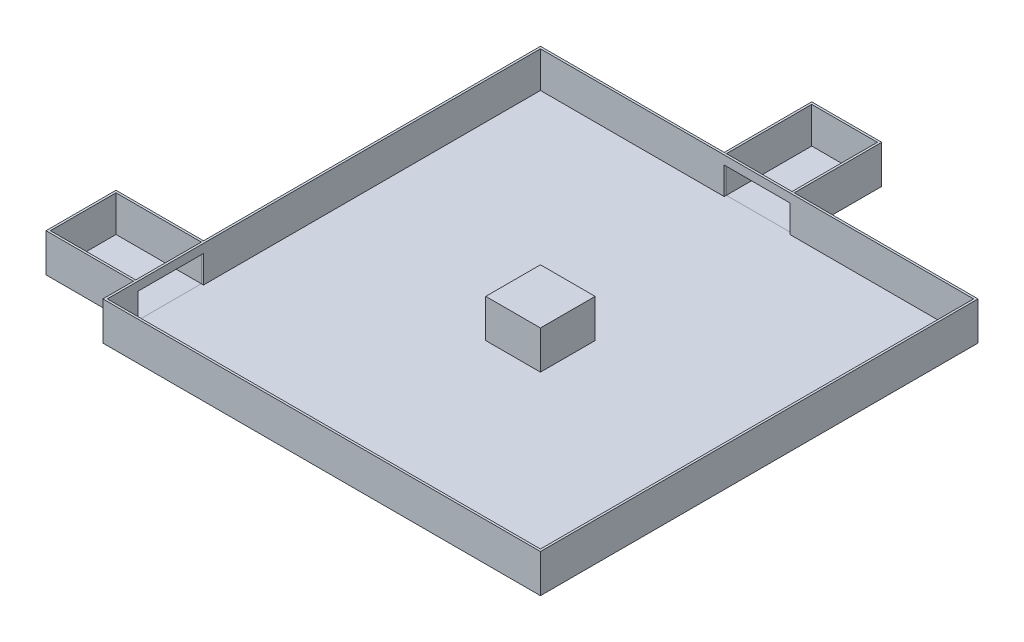
from build123d import *

# Parameters (mm, degrees)
SKETCH_1_W          = 4000
SKETCH_1_H          = 4000
EXTRUDE_1_DEPTH     = 350
SKETCH_2_W          = 3960
SKETCH_2_H          = 3960
CUT_EXTRUDE_1_DEPTH = 330
SKETCH_3_W          = 600
SKETCH_3_H          = 250
CUT_EXTRUDE_2_DEPTH = 20
SKETCH_5_W          = 600
SKETCH_5_H          = 250
CUT_EXTRUDE_3_DEPTH = 20
SKETCH_6_W          = 500
SKETCH_6_H          = 500
EXTRUDE_2_DEPTH     = 350
SKETCH_19_W         = 640
SKETCH_19_H         = 800
EXTRUDE_10_DEPTH    = 350
SKETCH_19_W_2       = 800
SKETCH_19_H_2       = 640
EXTRUDE_10_2_DEPTH  = 350
SKETCH_20_W         = 600
SKETCH_20_H         = 780
SKETCH_20_W_2       = 780
SKETCH_20_H_2       = 600
CUT_EXTRUDE_7_DEPTH = 330


with BuildPart() as part:
    # 草图1 → 凸台-拉伸1 (new body)
    with BuildSketch(Plane(origin=(0, 0, 0), x_dir=(1, 0, 0), z_dir=(0, 1, 0))):
        with Locations((2000, 2000)):
            Rectangle(SKETCH_1_W, SKETCH_1_H)
    extrude(amount=EXTRUDE_1_DEPTH)

    # 草图2 → 切除-拉伸1 (cut)
    with BuildSketch(Plane(origin=(0, 350, 0), x_dir=(1, 0, 0), z_dir=(0, 1, 0))):
        with Locations((2000, 2000)):
            Rectangle(SKETCH_2_W, SKETCH_2_H)
    extrude(amount=-CUT_EXTRUDE_1_DEPTH, mode=Mode.SUBTRACT)

    # 草图3 → 切除-拉伸2 (cut)
    with BuildSketch(Plane(origin=(0, 0, -4000), x_dir=(-1, 0, 0), z_dir=(0, 0, -1))):
        with Locations((-2000, 145)):
            Rectangle(SKETCH_3_W, SKETCH_3_H)
    extrude(amount=-CUT_EXTRUDE_2_DEPTH, mode=Mode.SUBTRACT)

    # 草图5 → 切除-拉伸3 (cut)
    with BuildSketch(Plane.ZY):
        with Locations((-600, 145)):
            Rectangle(SKETCH_5_W, SKETCH_5_H)
    extrude(amount=-CUT_EXTRUDE_3_DEPTH, mode=Mode.SUBTRACT)

    # 草图6 → 凸台-拉伸2 (add)
    with BuildSketch(Plane(origin=(0, 20, 0), x_dir=(1, 0, 0), z_dir=(0, 1, 0))):
        with Locations((2000, 2000)):
            Rectangle(SKETCH_6_W, SKETCH_6_H)
    extrude(amount=EXTRUDE_2_DEPTH)


with BuildPart() as body_2:
    # 草图19 → 凸台-拉伸10 (new body)
    with BuildSketch(Plane.XZ):
        with Locations((2000, -4400)):
            Rectangle(SKETCH_19_W, SKETCH_19_H)
    extrude(amount=-EXTRUDE_10_DEPTH)


with BuildPart() as body_3:
    # 草图19 → Extrude 10 2 (new body)
    with BuildSketch(Plane.XZ):
        with Locations((-400, -600)):
            Rectangle(SKETCH_19_W_2, SKETCH_19_H_2)
    extrude(amount=-EXTRUDE_10_2_DEPTH)


with BuildPart() as cut_extrude_7_tool:
    # 草图20 → 切除-拉伸7 (new body)
    with BuildSketch(Plane(origin=(0, 350, 0), x_dir=(1, 0, 0), z_dir=(0, 1, 0))):
        with Locations((2000, 4390)):
            Rectangle(SKETCH_20_W, SKETCH_20_H)
        with Locations((-390, 600)):
            Rectangle(SKETCH_20_W_2, SKETCH_20_H_2)
    extrude(amount=-CUT_EXTRUDE_7_DEPTH)


with BuildPart() as body_2_1:
    add(body_2.part)

    # 切除-拉伸7: cut by cut_extrude_7_tool
    add(cut_extrude_7_tool.part, mode=Mode.SUBTRACT)


with BuildPart() as body_3_1:
    add(body_3.part)

    # 切除-拉伸7: cut by cut_extrude_7_tool
    add(cut_extrude_7_tool.part, mode=Mode.SUBTRACT)


solid = Compound([part.part, body_2_1.part, body_3_1.part])
